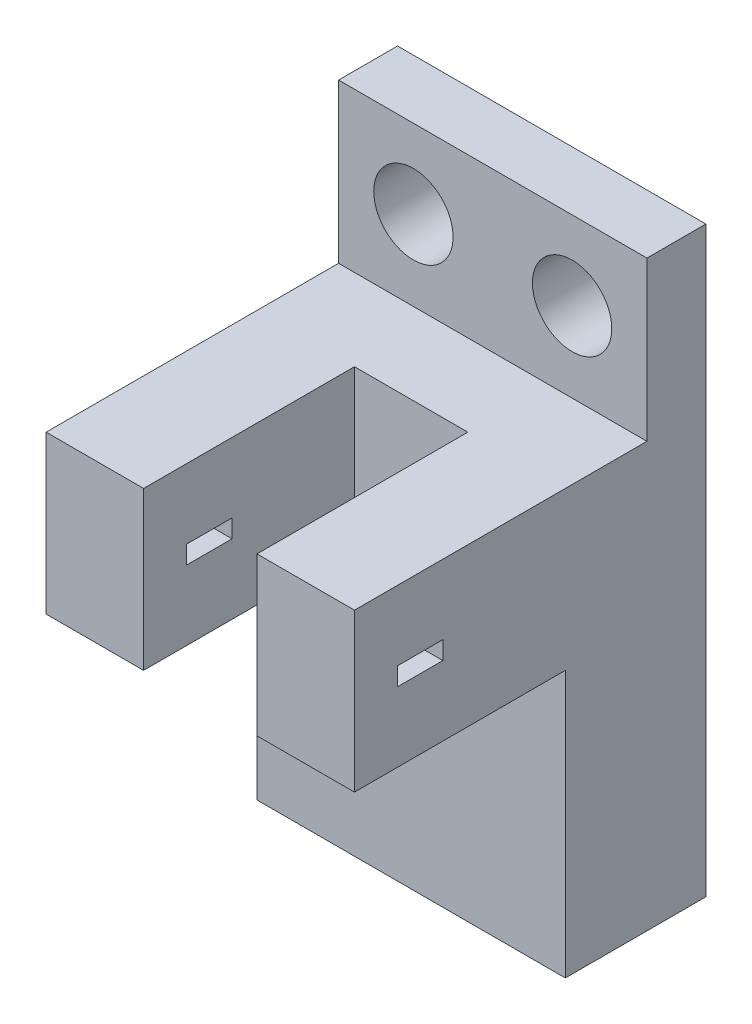
from build123d import *

# Parameters (mm, degrees)
SKETCH_1_W          = 13.6
SKETCH_1_H          = 18.7
EXTRUDE_1_DEPTH     = 6.2
SKETCH_2_W          = 4.3
SKETCH_2_H          = 6.95
EXTRUDE_2_DEPTH     = 9.3
SKETCH_3_W          = 13.6
SKETCH_3_H          = 7
SKETCH_3_R          = 1.75
EXTRUDE_3_DEPTH     = 2.6
SKETCH_4_W          = 2
SKETCH_4_H          = 0.8
CUT_EXTRUDE_1_DEPTH = 26.856720596


with BuildPart() as part:
    # 草图1 → 凸台-拉伸1 (new body)
    with BuildSketch(Plane.XY):
        with Locations((0, -0.75)):
            Rectangle(SKETCH_1_W, SKETCH_1_H)
    extrude(amount=EXTRUDE_1_DEPTH)

    # 草图2 → 凸台-拉伸2 (add)
    with BuildSketch(Plane.XY.offset(6.2)):
        with Locations((4.65, 5.125)):
            Rectangle(SKETCH_2_W, SKETCH_2_H)
        with Locations((-4.65, 5.125)):
            Rectangle(SKETCH_2_W, SKETCH_2_H)
    extrude(amount=EXTRUDE_2_DEPTH)

    # 草图3 → 凸台-拉伸3 (add)
    with BuildSketch(Plane(origin=(0, 0, 0), x_dir=(-1, 0, 0), z_dir=(0, 0, -1))):
        with Locations((0, 12.1)):
            Rectangle(SKETCH_3_W, SKETCH_3_H)
        with Locations((-3.5, 12.125)):
            Circle(SKETCH_3_R, mode=Mode.SUBTRACT)
        with Locations((3.5, 12.125)):
            Circle(SKETCH_3_R, mode=Mode.SUBTRACT)
    extrude(amount=-EXTRUDE_3_DEPTH)

    # 草图4 → 切除-拉伸1 (cut, through all)
    with BuildSketch(Plane(origin=(6.8, 0, 0), x_dir=(0, 0, -1), z_dir=(1, 0, 0))):
        with Locations((-12.6, 5.125)):
            Rectangle(SKETCH_4_W, SKETCH_4_H)
    extrude(amount=-CUT_EXTRUDE_1_DEPTH, mode=Mode.SUBTRACT)


solid = part.part
